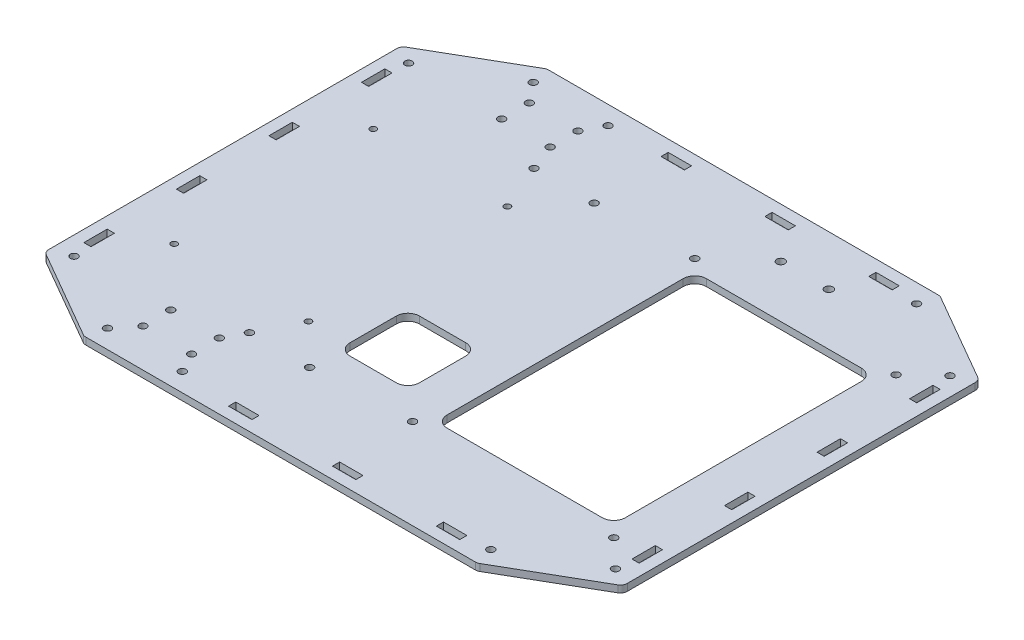
from build123d import *

# Parameters (mm, degrees)
SKETCH1_R           = 1.6
SKETCH1_R_2         = 1.59
SKETCH1_R_3         = 1.75
SKETCH1_W           = 10.1
SKETCH1_H           = 3.1
SKETCH1_W_2         = 3.1
SKETCH1_H_2         = 10.1
BOSS_EXTRUDE1_DEPTH = 3
CUT_EXTRUDE1_REACH  = 162.106
SKETCH3_R           = 1.35
SKETCH3_R_2         = 1.6
FILLET1_R           = 3


with BuildPart() as part:
    # Sketch1 → Boss-Extrude1 (new body)
    with BuildSketch(Plane(origin=(0, 0, 0), x_dir=(1, 0, 0), z_dir=(0, 1, 0))):
        Polygon((-85, 100), (85, 100), (125, 76.905989232), (125, -76.905989232), (85, -100), (-85, -100), (-125, -76.905989232), (-125, 76.905989232), align=None)
        with Locations(Location((-50.5, -63, 0), (0, 0, 270))):
            Circle(SKETCH1_R, mode=Mode.SUBTRACT)
        with Locations(Location((82.856406461, 92, 0), (0, 0, 270))):
            Circle(SKETCH1_R, mode=Mode.SUBTRACT)
        with Locations(Location((117, 72.287187079, 0), (0, 0, 270))):
            Circle(SKETCH1_R, mode=Mode.SUBTRACT)
        with Locations(Location((117, -72.287187079, 0), (0, 0, 270))):
            Circle(SKETCH1_R, mode=Mode.SUBTRACT)
        with Locations(Location((82.856406461, -92, 0), (0, 0, 270))):
            Circle(SKETCH1_R, mode=Mode.SUBTRACT)
        with Locations(Location((-24.5, -63, 0), (0, 0, 270))):
            Circle(SKETCH1_R, mode=Mode.SUBTRACT)
        with Locations(Location((-24.5, 60, 0), (0, 0, 270))):
            Circle(SKETCH1_R, mode=Mode.SUBTRACT)
        with Locations(Location((-117, -72.287187079, 0), (0, 0, 270))):
            Circle(SKETCH1_R, mode=Mode.SUBTRACT)
        with Locations(Location((-50.5, -92, 0), (0, 0, 270))):
            Circle(SKETCH1_R, mode=Mode.SUBTRACT)
        with Locations(Location((-50.5, 60, 0), (0, 0, 270))):
            Circle(SKETCH1_R, mode=Mode.SUBTRACT)
        with Locations(Location((-117, 72.287187079, 0), (0, 0, 270))):
            Circle(SKETCH1_R, mode=Mode.SUBTRACT)
        with Locations(Location((-50.5, 92, 0), (0, 0, 270))):
            Circle(SKETCH1_R, mode=Mode.SUBTRACT)
        with Locations(Location((-82.856406461, -92, 0), (0, 0, 270))):
            Circle(SKETCH1_R, mode=Mode.SUBTRACT)
        with Locations(Location((-82.856406461, 92, 0), (0, 0, 270))):
            Circle(SKETCH1_R, mode=Mode.SUBTRACT)
        with Locations(Location((-55, -83.5, 0), (0, 0, 270))):
            Circle(SKETCH1_R_2, mode=Mode.SUBTRACT)
        with Locations(Location((-76, -83.5, 0), (0, 0, 270))):
            Circle(SKETCH1_R_2, mode=Mode.SUBTRACT)
        with Locations(Location((-55, -71.5, 0), (0, 0, 90))):
            Circle(SKETCH1_R_2, mode=Mode.SUBTRACT)
        with Locations(Location((-76, -71.5, 0), (0, 0, 90))):
            Circle(SKETCH1_R_2, mode=Mode.SUBTRACT)
        with Locations(Location((-55, 71.5, 0), (0, 0, 270))):
            Circle(SKETCH1_R_2, mode=Mode.SUBTRACT)
        with Locations(Location((-55, 83.5, 0), (0, 0, 90))):
            Circle(SKETCH1_R_2, mode=Mode.SUBTRACT)
        with Locations(Location((-76, 83.5, 0), (0, 0, 90))):
            Circle(SKETCH1_R_2, mode=Mode.SUBTRACT)
        with Locations(Location((-76, 71.5, 0), (0, 0, 270))):
            Circle(SKETCH1_R_2, mode=Mode.SUBTRACT)
        with Locations(Location((37.707416379, 78.475, 0), (0, 0, 270))):
            Circle(SKETCH1_R_3, mode=Mode.SUBTRACT)
        with Locations(Location((58.457416379, 78.475, 0), (0, 0, 270))):
            Circle(SKETCH1_R_3, mode=Mode.SUBTRACT)
        with Locations((-22.45, -93.45)):
            Rectangle(SKETCH1_W, SKETCH1_H, mode=Mode.SUBTRACT)
        with Locations((-118.45, 60)):
            Rectangle(SKETCH1_W_2, SKETCH1_H_2, mode=Mode.SUBTRACT)
        with Locations((-118.45, 20)):
            Rectangle(SKETCH1_W_2, SKETCH1_H_2, mode=Mode.SUBTRACT)
        with Locations((-118.45, -20)):
            Rectangle(SKETCH1_W_2, SKETCH1_H_2, mode=Mode.SUBTRACT)
        with Locations((-118.45, -60)):
            Rectangle(SKETCH1_W_2, SKETCH1_H_2, mode=Mode.SUBTRACT)
        with Locations((118.45, -60)):
            Rectangle(SKETCH1_W_2, SKETCH1_H_2, mode=Mode.SUBTRACT)
        with Locations((118.45, -20)):
            Rectangle(SKETCH1_W_2, SKETCH1_H_2, mode=Mode.SUBTRACT)
        with Locations((118.45, 20)):
            Rectangle(SKETCH1_W_2, SKETCH1_H_2, mode=Mode.SUBTRACT)
        with Locations((118.45, 60)):
            Rectangle(SKETCH1_W_2, SKETCH1_H_2, mode=Mode.SUBTRACT)
        with Locations((22.45, -93.45)):
            Rectangle(SKETCH1_W, SKETCH1_H, mode=Mode.SUBTRACT)
        with Locations((67.35, -93.45)):
            Rectangle(SKETCH1_W, SKETCH1_H, mode=Mode.SUBTRACT)
        with Locations((67.35, 93.45)):
            Rectangle(SKETCH1_W, SKETCH1_H, mode=Mode.SUBTRACT)
        with Locations((22.45, 93.45)):
            Rectangle(SKETCH1_W, SKETCH1_H, mode=Mode.SUBTRACT)
        with Locations((-22.45, 93.45)):
            Rectangle(SKETCH1_W, SKETCH1_H, mode=Mode.SUBTRACT)
    extrude(amount=BOSS_EXTRUDE1_DEPTH)

    # Sketch3 → Cut-Extrude1 (cut, up to next)
    with BuildSketch(Plane(origin=(0, 3, 0), x_dir=(1, 0, 0), z_dir=(0, 1, 0)), mode=Mode.PRIVATE) as cut_extrude1_sk1:
        with Locations(Location((-100, -46, 0), (0, 0, 270))):
            Circle(SKETCH3_R)
    cut_extrude1_tool1 = extrude(cut_extrude1_sk1.sketch, amount=-CUT_EXTRUDE1_REACH, mode=Mode.PRIVATE) & part.part
    # Sketch3 → Cut-Extrude1 (cut, up to next)
    with BuildSketch(Plane(origin=(0, 3, 0), x_dir=(1, 0, 0), z_dir=(0, 1, 0)), mode=Mode.PRIVATE) as cut_extrude1_sk2:
        with Locations(Location((-42, -46, 0), (0, 0, 270))):
            Circle(SKETCH3_R)
    cut_extrude1_tool2 = extrude(cut_extrude1_sk2.sketch, amount=-CUT_EXTRUDE1_REACH, mode=Mode.PRIVATE) & part.part
    # Sketch3 → Cut-Extrude1 (cut, up to next)
    with BuildSketch(Plane(origin=(0, 3, 0), x_dir=(1, 0, 0), z_dir=(0, 1, 0)), mode=Mode.PRIVATE) as cut_extrude1_sk3:
        with Locations(Location((-42, 40, 0), (0, 0, 270))):
            Circle(SKETCH3_R)
    cut_extrude1_tool3 = extrude(cut_extrude1_sk3.sketch, amount=-CUT_EXTRUDE1_REACH, mode=Mode.PRIVATE) & part.part
    # Sketch3 → Cut-Extrude1 (cut, up to next)
    with BuildSketch(Plane(origin=(0, 3, 0), x_dir=(1, 0, 0), z_dir=(0, 1, 0)), mode=Mode.PRIVATE) as cut_extrude1_sk4:
        with Locations(Location((-100, 40, 0), (0, 0, 270))):
            Circle(SKETCH3_R)
    cut_extrude1_tool4 = extrude(cut_extrude1_sk4.sketch, amount=-CUT_EXTRUDE1_REACH, mode=Mode.PRIVATE) & part.part
    # Sketch3 → Cut-Extrude1 (cut, up to next)
    with BuildSketch(Plane(origin=(0, 3, 0), x_dir=(1, 0, 0), z_dir=(0, 1, 0)), mode=Mode.PRIVATE) as cut_extrude1_sk5:
        with Locations(Location((18, 61, 0), (0, 0, 270))):
            Circle(SKETCH3_R_2)
    cut_extrude1_tool5 = extrude(cut_extrude1_sk5.sketch, amount=-CUT_EXTRUDE1_REACH, mode=Mode.PRIVATE) & part.part
    # Sketch3 → Cut-Extrude1 (cut, up to next)
    with BuildSketch(Plane(origin=(0, 3, 0), x_dir=(1, 0, 0), z_dir=(0, 1, 0)), mode=Mode.PRIVATE) as cut_extrude1_sk6:
        with Locations(Location((105, 61, 0), (0, 0, 270))):
            Circle(SKETCH3_R_2)
    cut_extrude1_tool6 = extrude(cut_extrude1_sk6.sketch, amount=-CUT_EXTRUDE1_REACH, mode=Mode.PRIVATE) & part.part
    # Sketch3 → Cut-Extrude1 (cut, up to next)
    with BuildSketch(Plane(origin=(0, 3, 0), x_dir=(1, 0, 0), z_dir=(0, 1, 0)), mode=Mode.PRIVATE) as cut_extrude1_sk7:
        with Locations(Location((105, -61, 0), (0, 0, 270))):
            Circle(SKETCH3_R_2)
    cut_extrude1_tool7 = extrude(cut_extrude1_sk7.sketch, amount=-CUT_EXTRUDE1_REACH, mode=Mode.PRIVATE) & part.part
    # Sketch3 → Cut-Extrude1 (cut, up to next)
    with BuildSketch(Plane(origin=(0, 3, 0), x_dir=(1, 0, 0), z_dir=(0, 1, 0)), mode=Mode.PRIVATE) as cut_extrude1_sk8:
        with Locations(Location((18, -61, 0), (0, 0, 270))):
            Circle(SKETCH3_R_2)
    cut_extrude1_tool8 = extrude(cut_extrude1_sk8.sketch, amount=-CUT_EXTRUDE1_REACH, mode=Mode.PRIVATE) & part.part
    # Sketch3 → Cut-Extrude1 (cut, up to next)
    with BuildSketch(Plane(origin=(0, 3, 0), x_dir=(1, 0, 0), z_dir=(0, 1, 0)), mode=Mode.PRIVATE) as cut_extrude1_sk9:
        with BuildLine():
            Line((28, 56), (95, 56))
            ThreePointArc((95, 56), (98.535533906, 54.535533906), (100, 51))
            Line((100, 51), (100, -51))
            ThreePointArc((100, -51), (98.535533906, -54.535533906), (95, -56))
            Line((95, -56), (28, -56))
            ThreePointArc((28, -56), (24.464466094, -54.535533906), (23, -51))
            Line((23, -51), (23, 51))
            ThreePointArc((23, 51), (24.464466094, 54.535533906), (28, 56))
        make_face()
    cut_extrude1_tool9 = extrude(cut_extrude1_sk9.sketch, amount=-CUT_EXTRUDE1_REACH, mode=Mode.PRIVATE) & part.part
    # Sketch3 → Cut-Extrude1 (cut, up to next)
    with BuildSketch(Plane(origin=(0, 3, 0), x_dir=(1, 0, 0), z_dir=(0, 1, 0)), mode=Mode.PRIVATE) as cut_extrude1_sk10:
        with BuildLine():
            Line((-20, -50), (0, -50))
            ThreePointArc((0, -50), (3.535533906, -48.535533906), (5, -45))
            Line((5, -45), (5, -25))
            ThreePointArc((5, -25), (3.535533906, -21.464466094), (0, -20))
            Line((0, -20), (-20, -20))
            ThreePointArc((-20, -20), (-23.535533906, -21.464466094), (-25, -25))
            Line((-25, -25), (-25, -45))
            ThreePointArc((-25, -45), (-23.535533906, -48.535533906), (-20, -50))
        make_face()
    cut_extrude1_tool10 = extrude(cut_extrude1_sk10.sketch, amount=-CUT_EXTRUDE1_REACH, mode=Mode.PRIVATE) & part.part
    add(cut_extrude1_tool1.solids().sort_by_distance((-100, 3, 46))[0], mode=Mode.SUBTRACT)
    add(cut_extrude1_tool2.solids().sort_by_distance((-42, 3, 46))[0], mode=Mode.SUBTRACT)
    add(cut_extrude1_tool3.solids().sort_by_distance((-42, 3, -40))[0], mode=Mode.SUBTRACT)
    add(cut_extrude1_tool4.solids().sort_by_distance((-100, 3, -40))[0], mode=Mode.SUBTRACT)
    add(cut_extrude1_tool5.solids().sort_by_distance((18, 3, -61))[0], mode=Mode.SUBTRACT)
    add(cut_extrude1_tool6.solids().sort_by_distance((105, 3, -61))[0], mode=Mode.SUBTRACT)
    add(cut_extrude1_tool7.solids().sort_by_distance((105, 3, 61))[0], mode=Mode.SUBTRACT)
    add(cut_extrude1_tool8.solids().sort_by_distance((18, 3, 61))[0], mode=Mode.SUBTRACT)
    add(cut_extrude1_tool9.solids().sort_by_distance((61.5, 3, 0))[0], mode=Mode.SUBTRACT)
    add(cut_extrude1_tool10.solids().sort_by_distance((-10, 3, 35))[0], mode=Mode.SUBTRACT)

    # Fillet1
    fillet1_edges = [part.edges().sort_by_distance(p)[0] for p in [
        (-85, 1.5, -100),
        (85, 1.5, -100),
        (125, 1.5, -76.905989232),
        (125, 1.5, 76.905989232),
        (85, 1.5, 100),
        (-85, 1.5, 100),
        (-125, 1.5, 76.905989232),
        (-125, 1.5, -76.905989232),
    ]]
    fillet(fillet1_edges, radius=FILLET1_R)


solid = part.part
